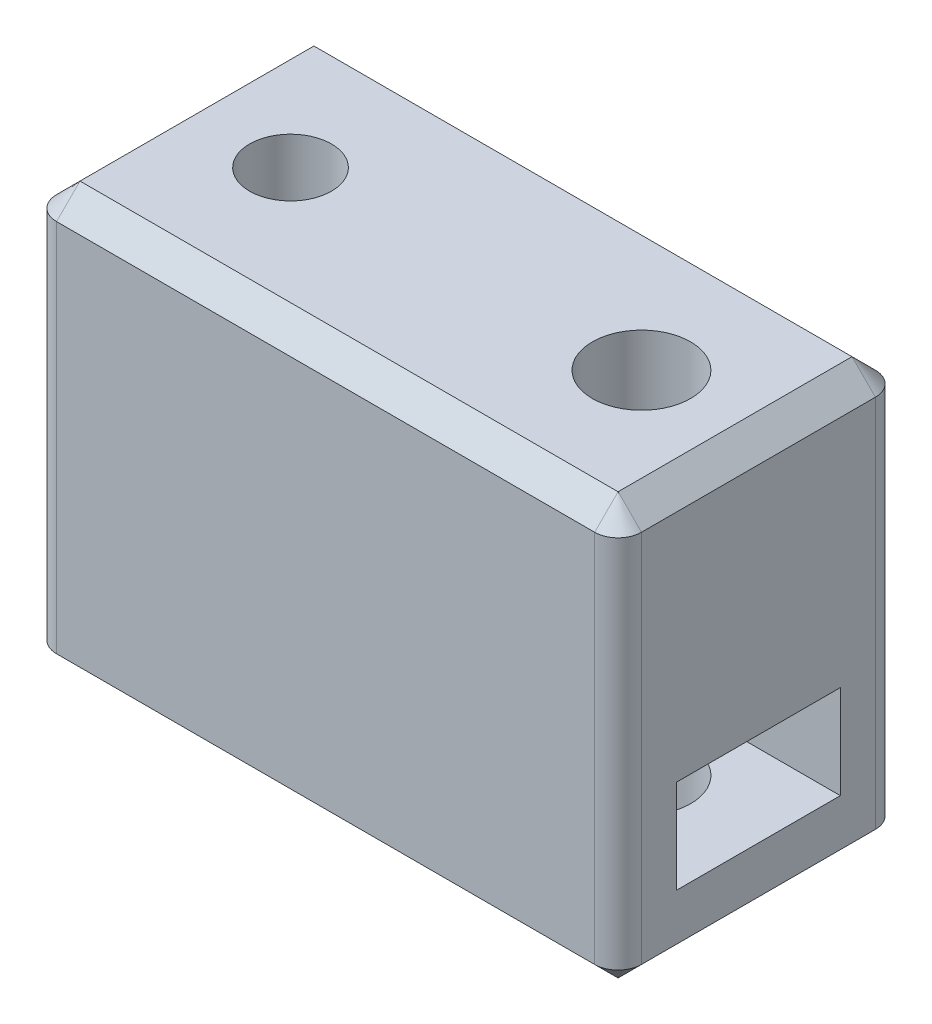
from build123d import *

# Parameters (mm, degrees)
SKETCH2_W           = 25
SKETCH2_H           = 12
SKETCH2_R           = 1.75
SKETCH2_R_2         = 2.1
BOSS_EXTRUDE1_DEPTH = 18
SKETCH7_W           = 7
SKETCH7_H           = 4
CUT_EXTRUDE3_DEPTH  = 10
SKETCH9_W           = 5.5
SKETCH9_H           = 3
CUT_EXTRUDE4_DEPTH  = 8
FILLET1_R           = 1
CHAMFER1_SIZE       = 1


with BuildPart() as part:
    # Sketch2 → Boss-Extrude1 (new body)
    with BuildSketch(Plane(origin=(0, 0, 0), x_dir=(1, 0, 0), z_dir=(0, 1, 0))):
        Rectangle(SKETCH2_W, SKETCH2_H)
        with Locations(Location((-7.5, 0, 0), (0, 0, 270))):
            Circle(SKETCH2_R, mode=Mode.SUBTRACT)
        with Locations(Location((7.5, 0, 0), (0, 0, 270))):
            Circle(SKETCH2_R_2, mode=Mode.SUBTRACT)
    extrude(amount=BOSS_EXTRUDE1_DEPTH)

    # Sketch7 → Cut-Extrude3 (cut)
    with BuildSketch(Plane(origin=(12.5, 0, 0), x_dir=(0, 0, -1), z_dir=(1, 0, 0))):
        with Locations((0, 5)):
            Rectangle(SKETCH7_W, SKETCH7_H)
    extrude(amount=-CUT_EXTRUDE3_DEPTH, mode=Mode.SUBTRACT)

    # Sketch9 → Cut-Extrude4 (cut)
    with BuildSketch(Plane.ZY.offset(12.5)):
        with Locations((0, 4.5)):
            Rectangle(SKETCH9_W, SKETCH9_H)
    extrude(amount=-CUT_EXTRUDE4_DEPTH, mode=Mode.SUBTRACT)

    # Fillet1
    fillet1_edges = [part.edges().sort_by_distance(p)[0] for p in [
        (12.5, 9, 6),
        (-12.5, 9, 6),
        (-12.5, 9, -6),
        (12.5, 9, -6),
    ]]
    fillet(fillet1_edges, radius=FILLET1_R)

    # Chamfer1
    chamfer1_edges = [part.edges().sort_by_distance(p)[0] for p in [
        (0, 0, 6),
        (0, 18, 6),
        (12.5, 0, 0),
        (-12.5, 0, 0),
        (0, 0, -6),
        (12.207106781, 0, 5.707106781),
        (12.207106781, 0, -5.707106781),
        (-12.207106781, 0, -5.707106781),
        (-12.207106781, 0, 5.707106781),
        (-12.5, 18, 0),
        (12.5, 18, 0),
        (0, 18, -6),
        (12.207106781, 18, 5.707106781),
        (12.207106781, 18, -5.707106781),
        (-12.207106781, 18, -5.707106781),
        (-12.207106781, 18, 5.707106781),
    ]]
    chamfer(chamfer1_edges, length=CHAMFER1_SIZE)


solid = part.part
